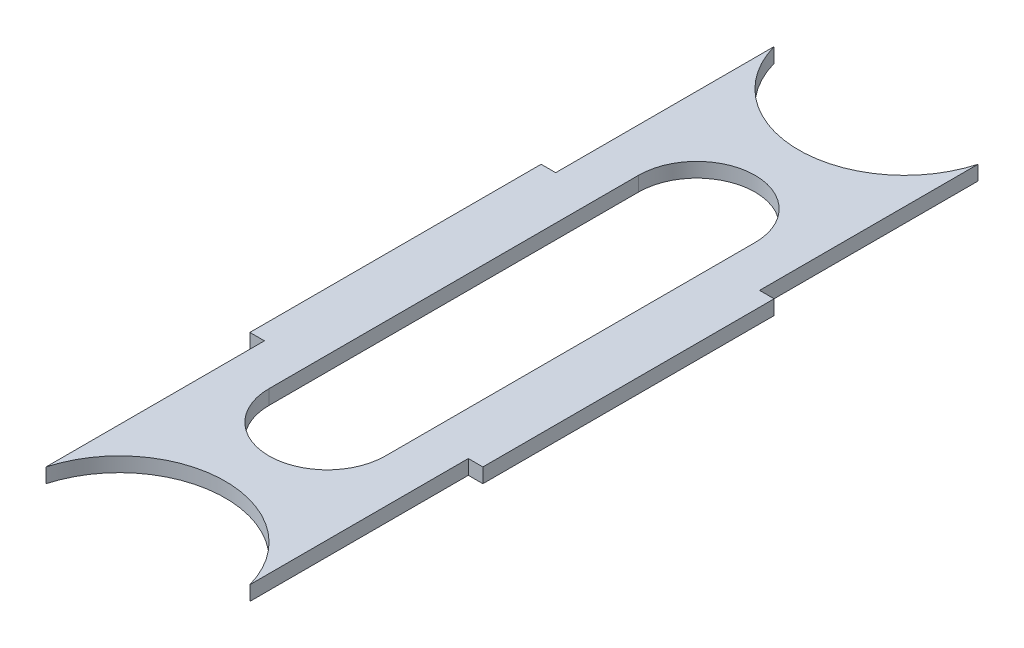
from build123d import *

# Parameters (mm, degrees)
SKETCH1_W           = 1.5875
SKETCH1_H           = 31.75
BOSS_EXTRUDE1_DEPTH = 1.5875


with BuildPart() as part:
    # Sketch1 → Boss-Extrude1 (new body)
    # profile 1 of 3: a face of its own
    with BuildSketch(Plane(origin=(0, 0, 0), x_dir=(1, 0, 0), z_dir=(0, 1, 0))):
        with BuildLine():
            Line((11.1125, -39.6875), (11.1125, -15.875))
            Line((11.1125, -15.875), (11.1125, 15.875))
            Line((11.1125, 15.875), (11.1125, 39.6875))
            ThreePointArc((11.1125, 39.6875), (0, 31.259108818), (-11.1125, 39.6875))
            Line((-11.1125, 39.6875), (-11.1125, 15.875))
            Line((-11.1125, 15.875), (-11.1125, -15.875))
            Line((-11.1125, -15.875), (-11.1125, -39.6875))
            ThreePointArc((-11.1125, -39.6875), (0, -31.259108818), (11.1125, -39.6875))
        make_face()
        with BuildLine():
            ThreePointArc((-6.35, 20.146608818), (0, 26.496608818), (6.35, 20.146608818))
            Line((6.35, 20.146608818), (6.35, -20.146608818))
            ThreePointArc((6.35, -20.146608818), (0, -26.496608818), (-6.35, -20.146608818))
            Line((-6.35, -20.146608818), (-6.35, 20.146608818))
        make_face(mode=Mode.SUBTRACT)
    # profile 2 of 3: a face of its own
    with BuildSketch(Plane(origin=(0, 0, 0), x_dir=(1, 0, 0), z_dir=(0, 1, 0))):
        with Locations((-11.90625, 0)):
            Rectangle(SKETCH1_W, SKETCH1_H)
    # profile 3 of 3: a face of its own
    with BuildSketch(Plane(origin=(0, 0, 0), x_dir=(1, 0, 0), z_dir=(0, 1, 0))):
        with Locations((11.90625, 0)):
            Rectangle(SKETCH1_W, SKETCH1_H)
    extrude(amount=BOSS_EXTRUDE1_DEPTH)


solid = part.part
